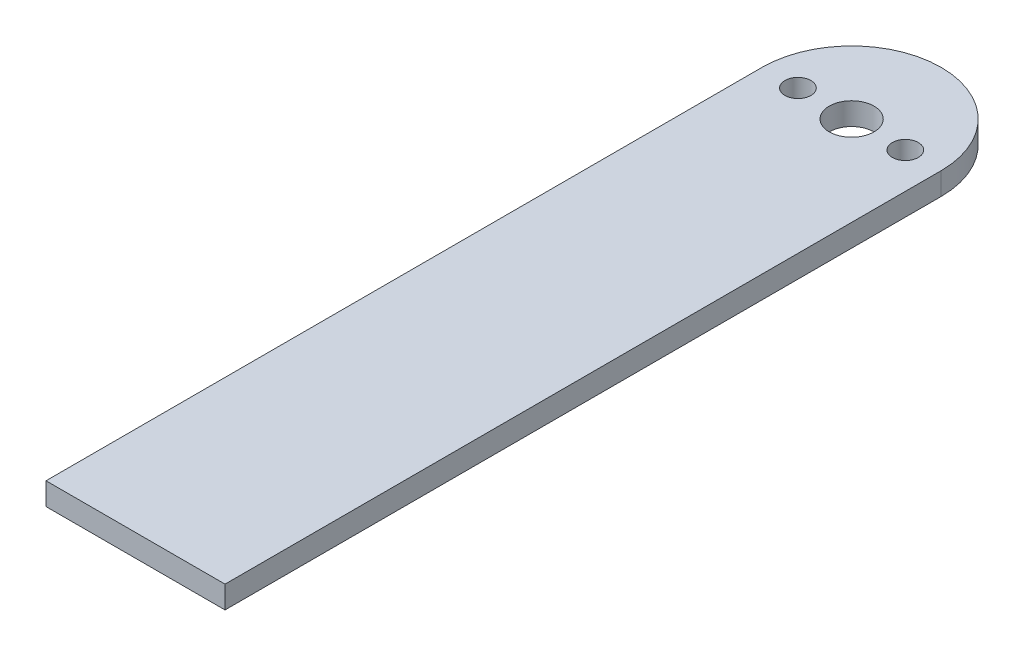
from build123d import *

# Parameters (mm, degrees)
SKETCH1_R           = 3.175
SKETCH1_R_2         = 1.8415
BOSS_EXTRUDE1_DEPTH = 3.175


with BuildPart() as part:
    # Sketch1 → Boss-Extrude1 (new body)
    with BuildSketch(Plane(origin=(0, 0, 0), x_dir=(1, 0, 0), z_dir=(0, 1, 0))):
        with BuildLine():
            Line((-12.7, 0), (-12.7, -101.6))
            Line((-12.7, -101.6), (12.7, -101.6))
            Line((12.7, -101.6), (12.7, 0))
            ThreePointArc((12.7, 0), (0, 12.7), (-12.7, 0))
        make_face()
        with Locations(Location((0, 0, 0), (0, 0, 270))):
            Circle(SKETCH1_R, mode=Mode.SUBTRACT)
        with Locations(Location((-7.62, 0, 0), (0, 0, 270))):
            Circle(SKETCH1_R_2, mode=Mode.SUBTRACT)
        with Locations(Location((7.62, 0, 0), (0, 0, 270))):
            Circle(SKETCH1_R_2, mode=Mode.SUBTRACT)
    extrude(amount=BOSS_EXTRUDE1_DEPTH)


solid = part.part
